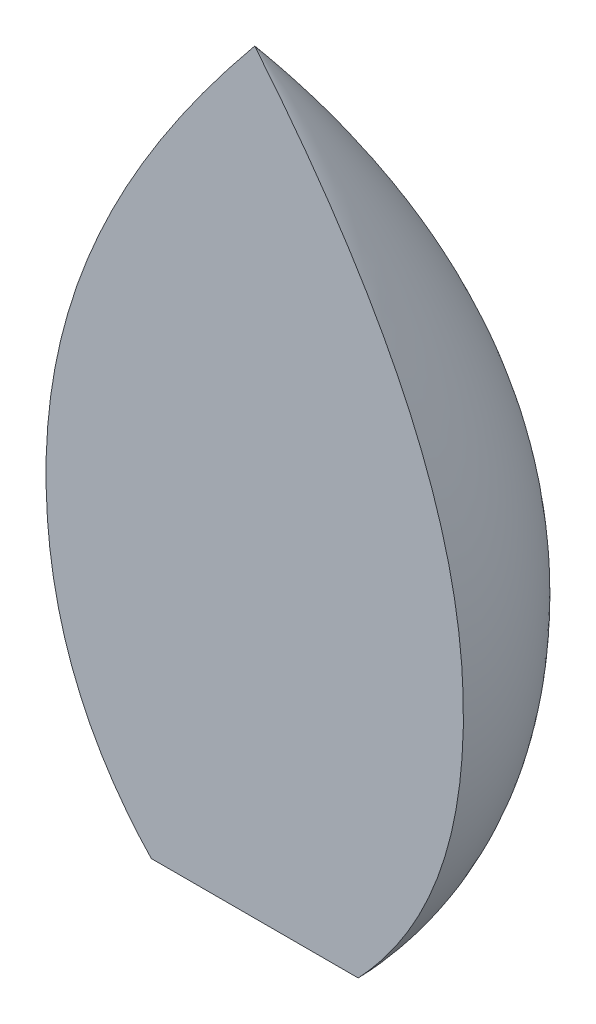
from build123d import *

# Parameters (mm, degrees)
REVOLVE_1_ANGLE = 180


with BuildPart() as part:
    # 草图2 → 旋转1 (revolve)
    with BuildSketch(Plane.XY):
        with BuildLine():
            Line((0, 0), (0, 50))
            add(Edge.make_bspline(
                [(0, 50), (15.28847781, 31.393398859), (21.10526888, 14.246209252), (19.266018227, -10.550351882), (14.249863608, -18.499152761), (10, -23)],
                knots=[0, 0, 0, 0, 0.506987184, 0.606987184, 1, 1, 1, 1], degree=3))
            Line((10, -23), (0, -23))
            Line((0, -23), (0, 0))
        make_face()
    revolve(axis=Axis((0, 0, 0), (0, 1, 0)), revolution_arc=REVOLVE_1_ANGLE)


solid = part.part
